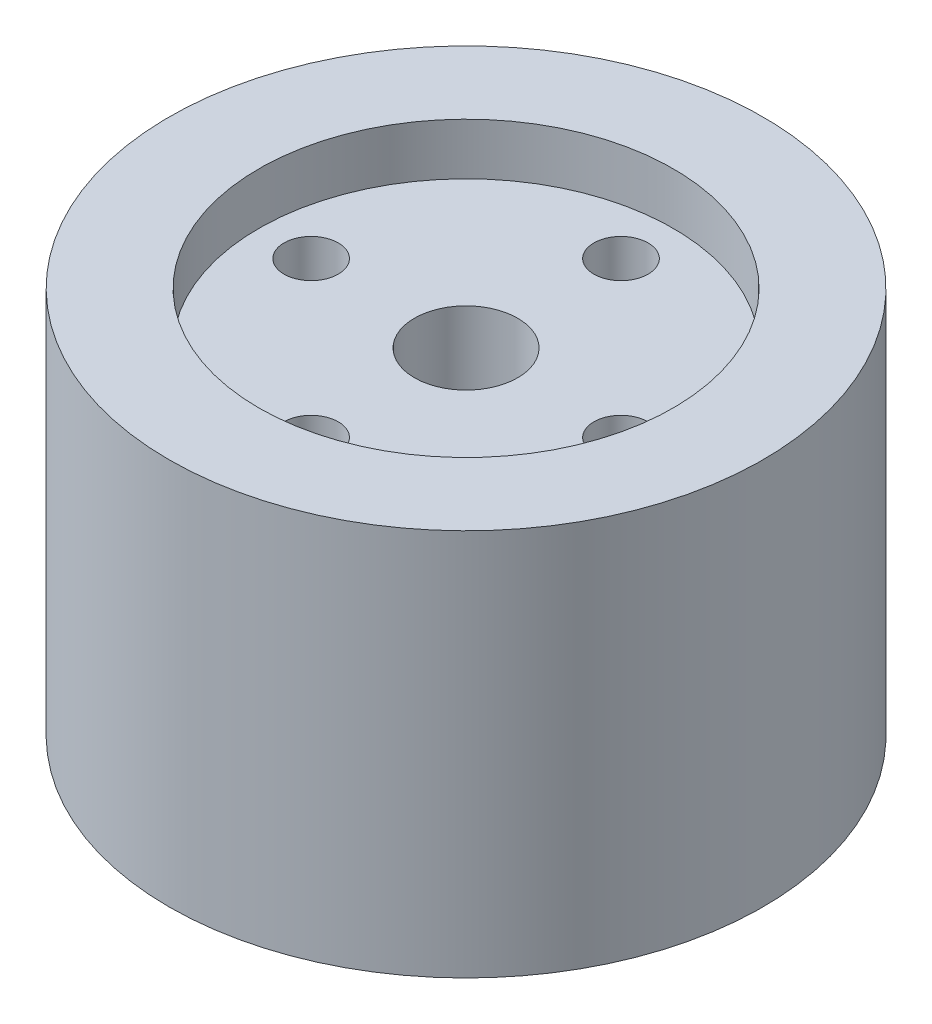
from build123d import *

# Parameters (mm, degrees)
SKETCH1_R           = 23
SKETCH1_R_2         = 4
SKETCH1_R_3         = 2.1
BOSS_EXTRUDE1_DEPTH = 30
SKETCH2_R           = 16.05
CUT_EXTRUDE1_DEPTH  = 4
CUT_EXTRUDE2_DEPTH  = 12


with BuildPart() as part:
    # Sketch1 → Boss-Extrude1 (new body)
    with BuildSketch(Plane(origin=(0, 0, 0), x_dir=(1, 0, 0), z_dir=(0, 1, 0))):
        with Locations(Location((0, 0, 0), (0, 0, 270))):
            Circle(SKETCH1_R)
        with Locations(Location((0, 0, 0), (0, 0, 270))):
            Circle(SKETCH1_R_2, mode=Mode.SUBTRACT)
        with Locations(Location((0, 12, 0), (0, 0, 270))):
            Circle(SKETCH1_R_3, mode=Mode.SUBTRACT)
        with Locations(Location((12, 0, 0), (0, 0, 270))):
            Circle(SKETCH1_R_3, mode=Mode.SUBTRACT)
        with Locations(Location((0, -12, 0), (0, 0, 270))):
            Circle(SKETCH1_R_3, mode=Mode.SUBTRACT)
        with Locations(Location((-12, 0, 0), (0, 0, 270))):
            Circle(SKETCH1_R_3, mode=Mode.SUBTRACT)
    extrude(amount=BOSS_EXTRUDE1_DEPTH)

    # Sketch2 → Cut-Extrude1 (cut)
    with BuildSketch(Plane(origin=(0, 30, 0), x_dir=(1, 0, 0), z_dir=(0, 1, 0))):
        with Locations(Location((0, 0, 0), (0, 0, 270))):
            Circle(SKETCH2_R)
    extrude(amount=-CUT_EXTRUDE1_DEPTH, mode=Mode.SUBTRACT)

    # Sketch3 → Cut-Extrude2 (cut)
    with BuildSketch(Plane.XZ):
        Polygon((12, -4.156921938), (15.6, -2.078460969), (15.6, 2.078460969), (12, 4.156921938), (8.4, 2.078460969), (8.4, -2.078460969), align=None)
        Polygon((4.156921938, 12), (2.078460969, 15.6), (-2.078460969, 15.6), (-4.156921938, 12), (-2.078460969, 8.4), (2.078460969, 8.4), align=None)
        Polygon((-4.156921938, -12), (-2.078460969, -15.6), (2.078460969, -15.6), (4.156921938, -12), (2.078460969, -8.4), (-2.078460969, -8.4), align=None)
        Polygon((-12, 4.156921938), (-15.6, 2.078460969), (-15.6, -2.078460969), (-12, -4.156921938), (-8.4, -2.078460969), (-8.4, 2.078460969), align=None)
    extrude(amount=-CUT_EXTRUDE2_DEPTH, mode=Mode.SUBTRACT)


solid = part.part
